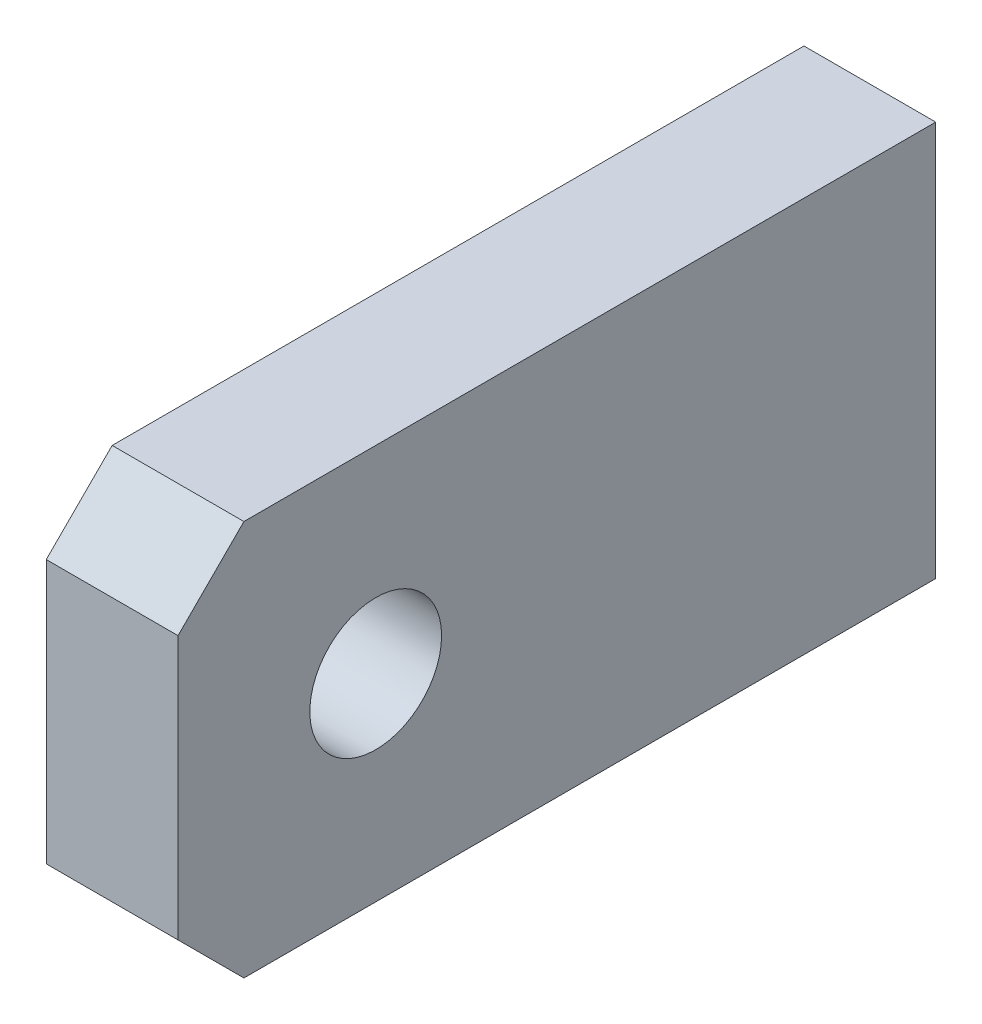
from build123d import *

# Parameters (mm, degrees)
SKETCH4_W           = 23
SKETCH4_H           = 12
BOSS_EXTRUDE2_DEPTH = 4
SKETCH5_R           = 1.5
CUT_EXTRUDE3_DEPTH  = 10
SKETCH6_R           = 2
CUT_EXTRUDE4_DEPTH  = 14.57387196
CHAMFER1_SIZE       = 2


with BuildPart() as part:
    # Sketch4 → Boss-Extrude2 (new body)
    with BuildSketch(Plane(origin=(0, 0, 0), x_dir=(0, 0, -1), z_dir=(1, 0, 0))):
        Rectangle(SKETCH4_W, SKETCH4_H)
    extrude(amount=-BOSS_EXTRUDE2_DEPTH)

    # Sketch5 → Cut-Extrude3 (cut)
    with BuildSketch(Plane(origin=(0, 0, -11.5), x_dir=(-1, 0, 0), z_dir=(0, 0, -1))):
        with Locations((2, -4)):
            Circle(SKETCH5_R)
        with Locations((2, 4)):
            Circle(SKETCH5_R)
    extrude(amount=-CUT_EXTRUDE3_DEPTH, mode=Mode.SUBTRACT)

    # Sketch6 → Cut-Extrude4 (cut, through all)
    with BuildSketch(Plane(origin=(0, 0, 0), x_dir=(0, 0, -1), z_dir=(1, 0, 0))):
        with Locations((-5.5, 0)):
            Circle(SKETCH6_R)
    extrude(amount=-CUT_EXTRUDE4_DEPTH, mode=Mode.SUBTRACT)

    # Chamfer1
    chamfer1_edges = [part.edges().sort_by_distance(p)[0] for p in [
        (-2, -6, 11.5),
        (-2, 6, 11.5),
    ]]
    chamfer(chamfer1_edges, length=CHAMFER1_SIZE)


solid = part.part
